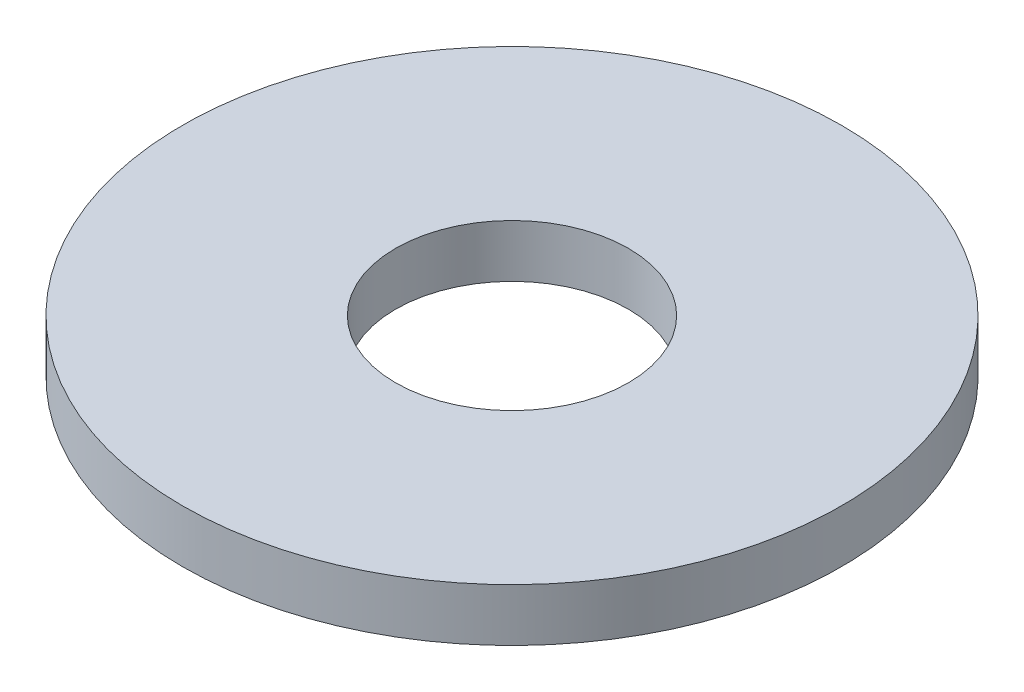
from build123d import *

# Parameters (mm, degrees)
SKETCH1_R           = 7.5
SKETCH1_R_2         = 2.65
BOSS_EXTRUDE1_DEPTH = 1.2


with BuildPart() as part:
    # Sketch1 → Boss-Extrude1 (new body)
    with BuildSketch(Plane(origin=(0, 0, 0), x_dir=(1, 0, 0), z_dir=(0, 1, 0))):
        with Locations(Location((0, 0, 0), (0, 0, 270))):
            Circle(SKETCH1_R)
        with Locations(Location((0, 0, 0), (0, 0, 270))):
            Circle(SKETCH1_R_2, mode=Mode.SUBTRACT)
    extrude(amount=BOSS_EXTRUDE1_DEPTH)


solid = part.part
